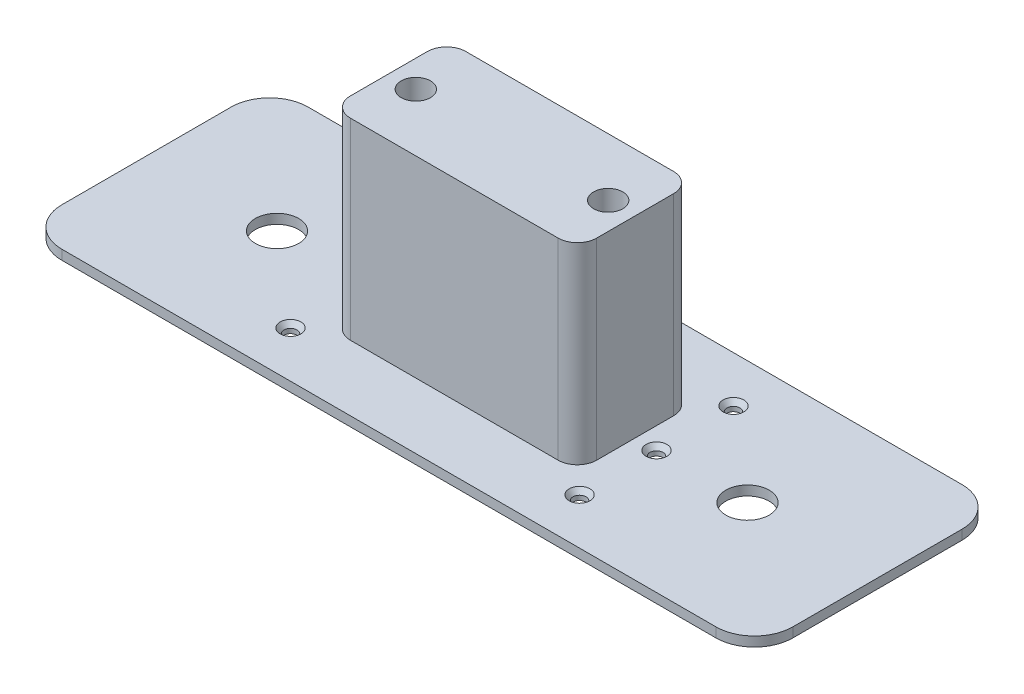
from build123d import *

# Parameters (mm, degrees)
SKETCH1_W                      = 120.65
SKETCH1_H                      = 40.64
BOSS_EXTRUDE1_DEPTH            = 1.5875
FILLET1_R                      = 6.35
SKETCH2_W                      = 40.64
SKETCH2_H                      = 19.05
BOSS_EXTRUDE2_DEPTH            = 31.75
FILLET2_R                      = 3.175
F_10_CLEARANCE_HOLE1_D         = 4.826
F_10_CLEARANCE_HOLE1_DEPTH     = 25.4
F_10_CLEARANCE_HOLE1_TIP       = 1.449876674
F_2_CLEARANCE_HOLE1_AT_2_COUNT = 2
F_2_CLEARANCE_HOLE1_AT_2_PITCH = 12.7
F_2_CLEARANCE_HOLE1_AT_3_COUNT = 2
F_2_CLEARANCE_HOLE1_AT_3_PITCH = 25.4
F_2_CLEARANCE_HOLE1_AT_4_COUNT = 2
F_2_CLEARANCE_HOLE1_AT_4_PITCH = 54.041188126
F_2_CLEARANCE_HOLE1_AT_5_COUNT = 2
F_2_CLEARANCE_HOLE1_AT_5_PITCH = 49.361726207
F_2_CLEARANCE_HOLE1_AT_6_COUNT = 2
F_2_CLEARANCE_HOLE1_AT_6_PITCH = 47.700000148
SKETCH13_R                     = 3.5749992
CUT_EXTRUDE1_DEPTH             = 72.856780691


with BuildPart() as part:
    # Sketch1 → Boss-Extrude1 (new body)
    with BuildSketch(Plane(origin=(0, 0, 0), x_dir=(1, 0, 0), z_dir=(0, 1, 0))):
        Rectangle(SKETCH1_W, SKETCH1_H)
    extrude(amount=BOSS_EXTRUDE1_DEPTH)

    # Fillet1
    fillet1_edges = [part.edges().sort_by_distance(p)[0] for p in [
        (60.325, 0.79375, 20.32),
        (-60.325, 0.79375, 20.32),
        (-60.325, 0.79375, -20.32),
        (60.325, 0.79375, -20.32),
    ]]
    fillet(fillet1_edges, radius=FILLET1_R)

    # Sketch2 → Boss-Extrude2 (add)
    with BuildSketch(Plane(origin=(0, 1.5875, 0), x_dir=(1, 0, 0), z_dir=(0, 1, 0))):
        Rectangle(SKETCH2_W, SKETCH2_H)
    extrude(amount=BOSS_EXTRUDE2_DEPTH)

    # Fillet2
    fillet2_edges = [part.edges().sort_by_distance(p)[0] for p in [
        (20.32, 17.4625, 9.525),
        (20.32, 17.4625, -9.525),
        (-20.32, 17.4625, -9.525),
        (-20.32, 17.4625, 9.525),
    ]]
    fillet(fillet2_edges, radius=FILLET2_R)

    # #10 Clearance Hole1
    with Locations(Plane(origin=(0, 33.3375, 0), x_dir=(1, 0, 0), z_dir=(0, 1, 0))):
        with Locations((-15.875, 0), (15.875, 0)):
            Hole(F_10_CLEARANCE_HOLE1_D / 2, depth=F_10_CLEARANCE_HOLE1_DEPTH)
            with Locations((0, 0, -(F_10_CLEARANCE_HOLE1_DEPTH + F_10_CLEARANCE_HOLE1_TIP / 2))):  # 118° drill point
                Cone(0, F_10_CLEARANCE_HOLE1_D / 2, F_10_CLEARANCE_HOLE1_TIP, mode=Mode.SUBTRACT)

    # Sketch12 → #2 Clearance Hole1 (revolve, cut)
    with BuildSketch(Plane(origin=(-23.850000074, 1.5875, -12.7), x_dir=(0, 0, 1), z_dir=(1, 0, 0))):
        Polygon((0, 0), (0, 1.5875), (1.0795, 1.5875), (1.0795, 0.827548112), (1.7145, 0), align=None)
    f_2_clearance_hole1 = revolve(axis=Axis((-23.850000074, 7.9375, -12.7), (0, -1, 0)), mode=Mode.SUBTRACT)

    # #2 Clearance Hole1 at 2: #2 Clearance Hole1 ×2
    with Locations(*[(0, 0, i * F_2_CLEARANCE_HOLE1_AT_2_PITCH) for i in range(1, F_2_CLEARANCE_HOLE1_AT_2_COUNT)]):
        add(f_2_clearance_hole1, mode=Mode.SUBTRACT)

    # #2 Clearance Hole1 at 3: #2 Clearance Hole1 ×2
    with Locations(*[(0, 0, i * F_2_CLEARANCE_HOLE1_AT_3_PITCH) for i in range(1, F_2_CLEARANCE_HOLE1_AT_3_COUNT)]):
        add(f_2_clearance_hole1, mode=Mode.SUBTRACT)

    # #2 Clearance Hole1 at 4: #2 Clearance Hole1 ×2
    with Locations(*[Vector(0.8826600931937462, 0, 0.4700118720662355) * (i * F_2_CLEARANCE_HOLE1_AT_4_PITCH) for i in range(1, F_2_CLEARANCE_HOLE1_AT_4_COUNT)]):
        add(f_2_clearance_hole1, mode=Mode.SUBTRACT)

    # #2 Clearance Hole1 at 5: #2 Clearance Hole1 ×2
    with Locations(*[Vector(0.9663357385056085, 0, 0.2572843572524773) * (i * F_2_CLEARANCE_HOLE1_AT_5_PITCH) for i in range(1, F_2_CLEARANCE_HOLE1_AT_5_COUNT)]):
        add(f_2_clearance_hole1, mode=Mode.SUBTRACT)

    # #2 Clearance Hole1 at 6: #2 Clearance Hole1 ×2
    with Locations(*[(i * F_2_CLEARANCE_HOLE1_AT_6_PITCH, 0, 0) for i in range(1, F_2_CLEARANCE_HOLE1_AT_6_COUNT)]):
        add(f_2_clearance_hole1, mode=Mode.SUBTRACT)

    # Sketch13 → Cut-Extrude1 (cut, through all)
    with BuildSketch(Plane(origin=(0, 0, 0), x_dir=(-1, 0, 0), z_dir=(0, -1, 0))):
        with Locations(Location((38.825000074, 0.042792778, 0), (0, 0, 90))):
            Circle(SKETCH13_R)
        with Locations(Location((-38.825000074, 0.042792778, 0), (0, 0, 270))):
            Circle(SKETCH13_R)
    extrude(amount=-CUT_EXTRUDE1_DEPTH, mode=Mode.SUBTRACT)


solid = part.part
